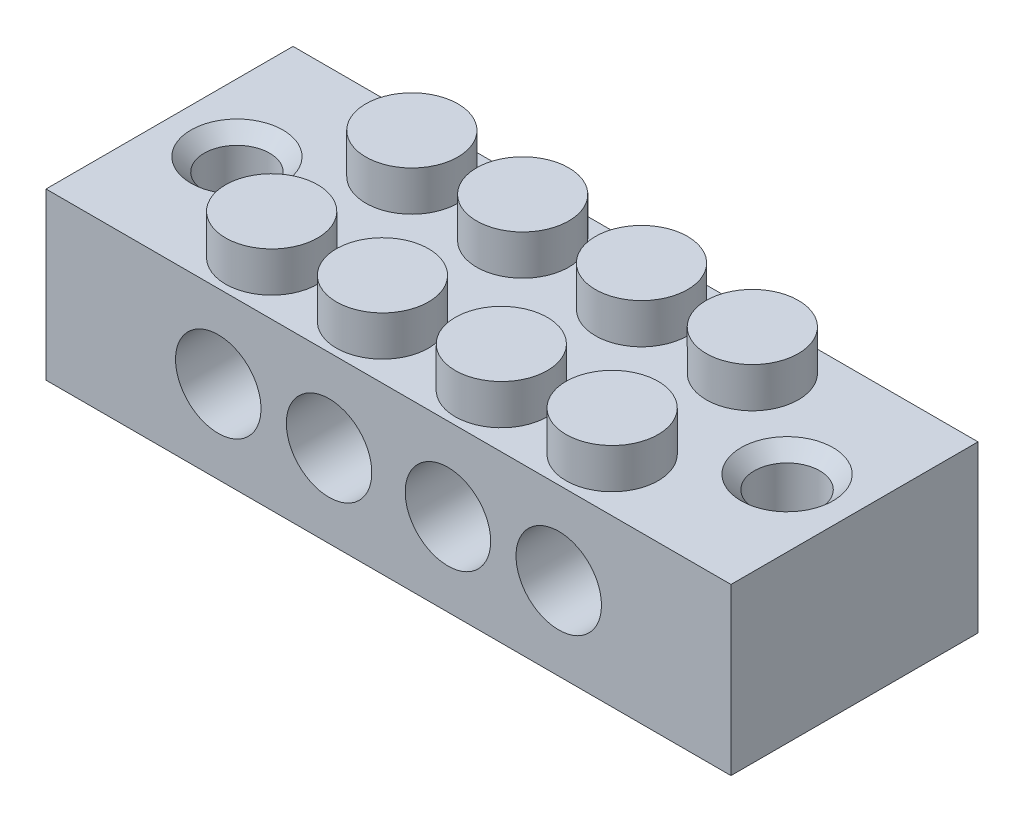
from build123d import *

# Parameters (mm, degrees)
SKETCH1_W               = 51.3
SKETCH1_H               = 18.5
BOSS_EXTRUDE1_DEPTH     = 12.4
SKETCH2_R               = 3.2
CUT_EXTRUDE1_DEPTH      = 34.969581982
SKETCH3_R               = 2.45
CUT_EXTRUDE2_DEPTH      = 30.95404814
CHAMFER1_SIZE           = 1
SKETCH4_R               = 3.45
BOSS_EXTRUDE2_DEPTH     = 3
MIRROR3_COPY_1_SKETCH_R = 3.45
MIRROR3_COPY_1_DEPTH    = 3


with BuildPart() as part:
    # Sketch1 → Boss-Extrude1 (new body)
    with BuildSketch(Plane(origin=(0, 0, 0), x_dir=(1, 0, 0), z_dir=(0, 1, 0))):
        Rectangle(SKETCH1_W, SKETCH1_H)
    extrude(amount=BOSS_EXTRUDE1_DEPTH)

    # Sketch2 → Cut-Extrude1 (cut, through all)
    with BuildSketch(Plane.XY.offset(9.25)):
        with Locations((4.45, 6.2)):
            Circle(SKETCH2_R)
        with Locations((12.75, 6.2)):
            Circle(SKETCH2_R)
    cut_extrude1 = extrude(amount=-CUT_EXTRUDE1_DEPTH, mode=Mode.SUBTRACT)

    # Sketch3 → Cut-Extrude2 (cut, through all)
    with BuildSketch(Plane(origin=(0, 12.4, 0), x_dir=(1, 0, 0), z_dir=(0, 1, 0))):
        with Locations(Location((20.6, 0, 0), (0, 0, 270))):
            Circle(SKETCH3_R)
    cut_extrude2 = extrude(amount=-CUT_EXTRUDE2_DEPTH, mode=Mode.SUBTRACT)

    # Mirror1: Cut-Extrude1, Cut-Extrude2 across plane
    add(cut_extrude1.mirror(Plane(origin=(0, 0, 0), x_dir=(0, 0, 1), z_dir=(1, 0, 0))), mode=Mode.SUBTRACT)
    add(cut_extrude2.mirror(Plane(origin=(0, 0, 0), x_dir=(0, 0, 1), z_dir=(1, 0, 0))), mode=Mode.SUBTRACT)

    # Chamfer1
    chamfer1_edges = [part.edges().sort_by_distance(p)[0] for p in [
        (20.6, 12.4, -2.45),
        (-20.6, 12.4, -2.45),
    ]]
    chamfer(chamfer1_edges, length=CHAMFER1_SIZE)

    # Sketch4 → Boss-Extrude2 (add)
    with BuildSketch(Plane(origin=(0, 12.4, 0), x_dir=(1, 0, 0), z_dir=(0, 1, 0))):
        with Locations(Location((4.45, -5.25, 0), (0, 0, 270))):
            Circle(SKETCH4_R)
        with Locations(Location((12.75, -5.25, 0), (0, 0, 270))):
            Circle(SKETCH4_R)
    boss_extrude2 = extrude(amount=BOSS_EXTRUDE2_DEPTH)

    # Mirror2: Boss-Extrude2 across plane
    add(boss_extrude2.mirror(Plane.XY))

    # Mirror3: Boss-Extrude2 across plane
    add(boss_extrude2.mirror(Plane(origin=(0, 0, 0), x_dir=(0, 0, 1), z_dir=(1, 0, 0))))

    # Mirror3 copy 1 sketch → Mirror3 copy 1 (add)
    with BuildSketch(Plane(origin=(0, 12.4, 0), x_dir=(-1, 0, 0), z_dir=(0, 1, 0))):
        with Locations(Location((4.45, -5.25, 0), (0, 0, 270))):
            Circle(MIRROR3_COPY_1_SKETCH_R)
        with Locations(Location((12.75, -5.25, 0), (0, 0, 270))):
            Circle(MIRROR3_COPY_1_SKETCH_R)
    extrude(amount=MIRROR3_COPY_1_DEPTH)


solid = part.part
